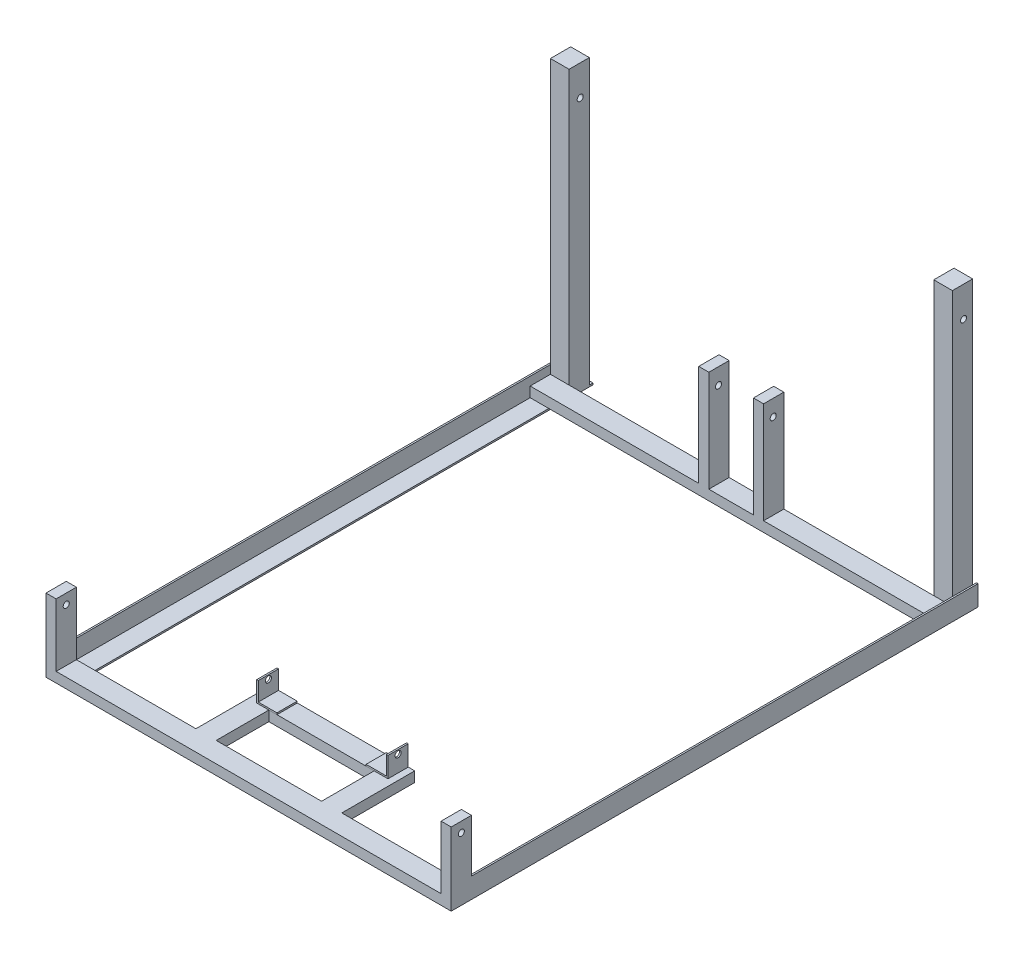
from build123d import *

# Parameters (mm, degrees)
BOSS_EXTRUDE1_DEPTH     = 50
SKETCH2_W               = 360
SKETCH2_H               = 25
BOSS_EXTRUDE3_DEPTH     = 230
SKETCH3_W               = 260
SKETCH3_H               = 130
CUT_EXTRUDE1_DEPTH      = 230
BOSS_EXTRUDE4_DEPTH     = 1250
BOSS_EXTRUDE5_DEPTH     = 1250
SKETCH7_W               = 46
SKETCH7_H               = 50
BOSS_EXTRUDE6_DEPTH     = 700
SKETCH10_W              = 50
SKETCH10_H              = 25
BOSS_EXTRUDE7_DEPTH     = 992
SKETCH11_R              = 7.5
CUT_EXTRUDE2_DEPTH      = 1012
SKETCH12_W              = 50
SKETCH12_H              = 50
BOSS_EXTRUDE8_DEPTH     = 4
SKETCH13_W              = 4
SKETCH13_H              = 50
BOSS_EXTRUDE9_DEPTH     = 50
SKETCH15_R              = 7.5
CUT_EXTRUDE3_DEPTH      = 380
CUT_EXTRUDE5_DEPTH      = 1743.470523401
CUT_EXTRUDE5_DEPTH_BACK = 1743.470523401
SKETCH16_R              = 7.5
SKETCH17_W              = 25
SKETCH17_H              = 50
BOSS_EXTRUDE10_DEPTH    = 250
SKETCH18_R              = 7.5
CUT_EXTRUDE6_DEPTH      = 250


with BuildPart() as part:
    # Sketch1 → Boss-Extrude1 (new body)
    with BuildSketch(Plane.XY):
        Polygon((-915.830763168, 0), (34.169236832, 0), (34.169236832, 155), (59.169236832, 155), (59.169236832, -25), (-940.830763168, -25), (-940.830763168, 155), (-915.830763168, 155), align=None)
    extrude(amount=-BOSS_EXTRUDE1_DEPTH)

    # Sketch2 → Boss-Extrude3 (add)
    with BuildSketch(Plane.XY):
        with Locations((-440.830763168, -12.5)):
            Rectangle(SKETCH2_W, SKETCH2_H)
    extrude(amount=-BOSS_EXTRUDE3_DEPTH)

    # Sketch3 → Cut-Extrude1 (cut)
    with BuildSketch(Plane(origin=(0, 0, 0), x_dir=(1, 0, 0), z_dir=(0, 1, 0))):
        with Locations((-440.830763168, 115)):
            Rectangle(SKETCH3_W, SKETCH3_H)
    extrude(amount=-CUT_EXTRUDE1_DEPTH, mode=Mode.SUBTRACT)

    # Sketch4 → Boss-Extrude4 (add)
    with BuildSketch(Plane(origin=(0, 0, -50), x_dir=(-1, 0, 0), z_dir=(0, 0, -1))):
        Polygon((-59.169236832, 25), (-59.169236832, -25), (-9.169236832, -25), (-9.169236832, -21), (-55.169236832, -21), (-55.169236832, 25), align=None)
    extrude(amount=BOSS_EXTRUDE4_DEPTH)

    # Sketch6 → Boss-Extrude5 (add)
    with BuildSketch(Plane(origin=(0, 0, -50), x_dir=(-1, 0, 0), z_dir=(0, 0, -1))):
        Polygon((940.830763168, 25), (940.830763168, -25), (890.830763168, -25), (890.830763168, -21), (936.830763168, -21), (936.830763168, 25), align=None)
    extrude(amount=BOSS_EXTRUDE5_DEPTH)

    # Sketch7 → Boss-Extrude6 (add)
    with BuildSketch(Plane(origin=(0, -21, 0), x_dir=(1, 0, 0), z_dir=(0, 1, 0))):
        with Locations((-913.830763168, 1265.818413322)):
            Rectangle(SKETCH7_W, SKETCH7_H)
        with Locations((32.169236832, 1265.818413322)):
            Rectangle(SKETCH7_W, SKETCH7_H)
    extrude(amount=BOSS_EXTRUDE6_DEPTH)

    # Sketch10 → Boss-Extrude7 (add)
    with BuildSketch(Plane(origin=(-936.830763168, 0, 0), x_dir=(0, 0, -1), z_dir=(1, 0, 0))):
        with Locations((1215.818413322, -8.5)):
            Rectangle(SKETCH10_W, SKETCH10_H)
    extrude(amount=BOSS_EXTRUDE7_DEPTH)

    # Sketch11 → Cut-Extrude2 (cut)
    with BuildSketch(Plane.ZY.offset(940.830763168)):
        with Locations((-25, 130)):
            Circle(SKETCH11_R)
    extrude(amount=-CUT_EXTRUDE2_DEPTH, mode=Mode.SUBTRACT)

    # Sketch12 → Boss-Extrude8 (add)
    with BuildSketch(Plane(origin=(0, 0, 0), x_dir=(1, 0, 0), z_dir=(0, 1, 0))):
        with Locations((-575.830763168, 204.911627509)):
            Rectangle(SKETCH12_W, SKETCH12_H)
        with Locations((-305.830763168, 204.911627509)):
            Rectangle(SKETCH12_W, SKETCH12_H)
    extrude(amount=BOSS_EXTRUDE8_DEPTH)

    # Sketch13 → Boss-Extrude9 (add)
    with BuildSketch(Plane(origin=(0, 0, 0), x_dir=(1, 0, 0), z_dir=(0, 1, 0))):
        with Locations((-598.830763168, 204.911627509)):
            Rectangle(SKETCH13_W, SKETCH13_H)
        with Locations((-278.830763168, 204.911627509)):
            Rectangle(SKETCH13_W, SKETCH13_H)
    extrude(amount=BOSS_EXTRUDE9_DEPTH)

    # Sketch15 → Cut-Extrude3 (cut)
    with BuildSketch(Plane.ZY.offset(600.830763168)):
        with Locations((-204.911627509, 40)):
            Circle(SKETCH15_R)
    extrude(amount=-CUT_EXTRUDE3_DEPTH, mode=Mode.SUBTRACT)

    # Sketch16 → Cut-Extrude5 (cut, two sides: drawn at the far end of the back side and taken through both)
    with BuildSketch(Plane(origin=(0, 0, 0), x_dir=(0, 0, -1), z_dir=(1, 0, 0)).offset(-CUT_EXTRUDE5_DEPTH_BACK)):
        with Locations((1268.318413322, 604)):
            Circle(SKETCH16_R)
    extrude(amount=CUT_EXTRUDE5_DEPTH + CUT_EXTRUDE5_DEPTH_BACK, mode=Mode.SUBTRACT)

    # Sketch17 → Boss-Extrude10 (add)
    with BuildSketch(Plane(origin=(0, 4, 0), x_dir=(1, 0, 0), z_dir=(0, 1, 0))):
        with Locations((-508.330763168, 1215.818413322)):
            Rectangle(SKETCH17_W, SKETCH17_H)
        with Locations((-373.330763168, 1215.818413322)):
            Rectangle(SKETCH17_W, SKETCH17_H)
    extrude(amount=BOSS_EXTRUDE10_DEPTH)

    # Sketch18 → Cut-Extrude6 (cut)
    with BuildSketch(Plane.ZY.offset(520.830763168)):
        with Locations((-1214.592207536, 214)):
            Circle(SKETCH18_R)
    extrude(amount=-CUT_EXTRUDE6_DEPTH, mode=Mode.SUBTRACT)


solid = part.part
